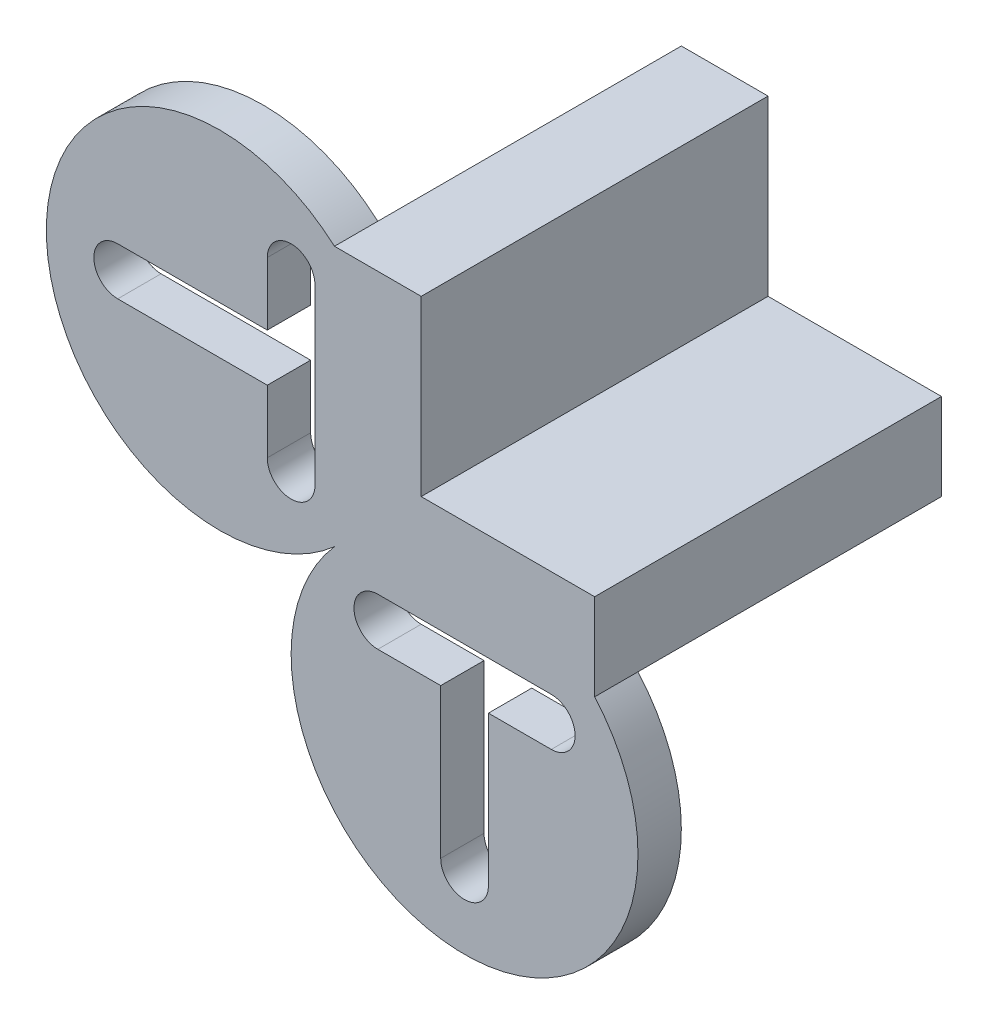
from build123d import *

# Parameters (mm, degrees)
WALLS_DEPTH = 40
TABS_DEPTH  = 5
HOLES_DEPTH = 71.444664714


with BuildPart() as part:
    # Sketch1 → Walls (new body)
    with BuildSketch(Plane.XY):
        Polygon((0, 20), (-10, 20), (-10, -10), (20, -10), (20, 0), (0, 0), align=None)
    extrude(amount=-WALLS_DEPTH)

    # Sketch2 → Tabs (add)
    with BuildSketch(Plane.XY):
        with BuildLine():
            Line((20, -10), (-10, -10))
            ThreePointArc((-10, -10), (5, -43.228756555), (20, -10))
        make_face()
        with BuildLine():
            Line((-10, -10), (-10, 20))
            ThreePointArc((-10, 20), (-43.228756555, 5), (-10, -10))
        make_face()
    extrude(amount=-TABS_DEPTH)

    # Sketch3 → Holes (cut, through all)
    with BuildSketch(Plane(origin=(0, 0, -5), x_dir=(-1, 0, 0), z_dir=(0, 0, -1))):
        with BuildLine():
            Line((12.25, -5), (12.25, 15))
            ThreePointArc((12.25, 15), (15, 17.75), (17.75, 15))
            Line((17.75, 15), (17.75, 7.75))
            Line((17.75, 7.75), (35, 7.75))
            ThreePointArc((35, 7.75), (37.75, 5), (35, 2.25))
            Line((35, 2.25), (17.75, 2.25))
            Line((17.75, 2.25), (17.75, -5))
            ThreePointArc((17.75, -5), (15, -7.75), (12.25, -5))
        make_face()
        with BuildLine():
            Line((5, -17.75), (-2.25, -17.75))
            Line((-2.25, -17.75), (-2.25, -35))
            ThreePointArc((-2.25, -35), (-5, -37.75), (-7.75, -35))
            Line((-7.75, -35), (-7.75, -17.75))
            Line((-7.75, -17.75), (-15, -17.75))
            ThreePointArc((-15, -17.75), (-17.75, -15), (-15, -12.25))
            Line((-15, -12.25), (5, -12.25))
            ThreePointArc((5, -12.25), (7.75, -15), (5, -17.75))
        make_face()
    extrude(amount=-HOLES_DEPTH, mode=Mode.SUBTRACT)


solid = part.part
